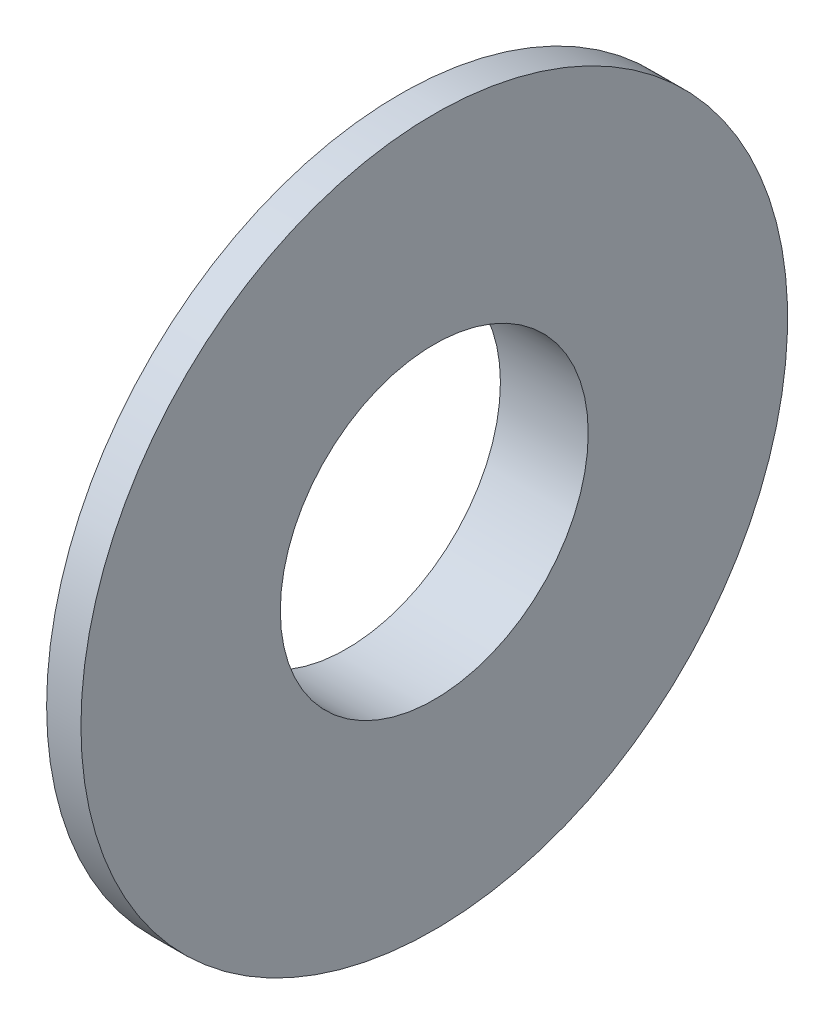
from build123d import *


with BuildPart() as part:
    # Sketch1 → Revolve1 (revolve)
    with BuildSketch(Plane.XY, mode=Mode.PRIVATE) as revolve1_sk:
        with BuildLine():
            Line((0, 13.5), (0, 20.045307035))
            Line((0, 20.045307035), (1.031558465, 20.045307035))
            ThreePointArc((1.031558465, 20.045307035), (1.854731333, 25.146569177), (4.69108464, 29.465780785))
            Line((4.69108464, 29.465780785), (4.69108464, 30.981308411))
            Line((4.69108464, 30.981308411), (7.7, 30.981308411))
            Line((7.7, 30.981308411), (7.7, 13.5))
            Line((7.7, 13.5), (0, 13.5))
        make_face()
    revolve(revolve1_sk.sketch.rotate(Axis((-66.093457944, 0, 0), (1, 0, 0)), 90), axis=Axis((-66.093457944, 0, 0), (1, 0, 0)))


solid = part.part
